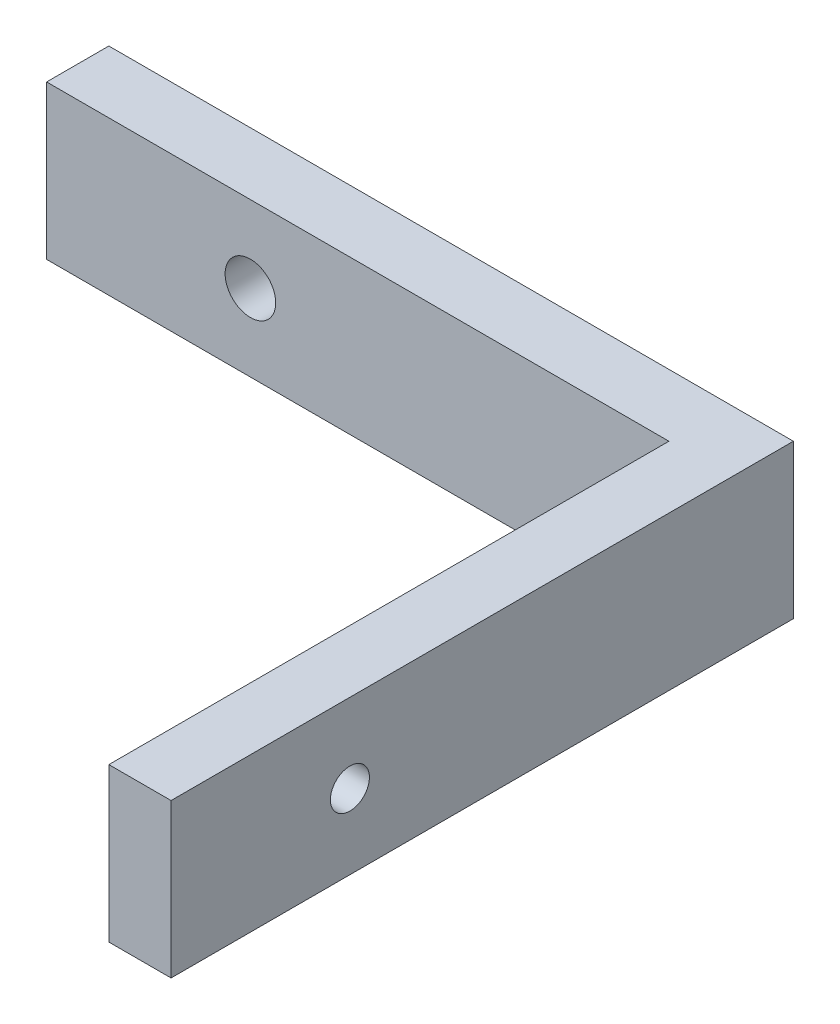
from build123d import *

# Parameters (mm, degrees)
SKETCH_1_W      = 65.498017076
SKETCH_1_H      = 24.698375637
SKETCH_1_R      = 4.065381732
EXTRUDE_1_DEPTH = 10
SKETCH_2_W      = 34.501982924
SKETCH_2_H      = 24.698375637
EXTRUDE_2_DEPTH = 10
SKETCH_3_W      = 100
SKETCH_3_H      = 24.698375637
SKETCH_3_R      = 3.135440561
EXTRUDE_3_DEPTH = 10


with BuildPart() as part:
    # 草图1 → 凸台-拉伸1 (new body)
    with BuildSketch(Plane.XY):
        with Locations((39.890553187, 50.738604847)):
            Rectangle(SKETCH_1_W, SKETCH_1_H)
        with Locations((39.890553187, 50.738604847)):
            Circle(SKETCH_1_R, mode=Mode.SUBTRACT)
    extrude(amount=-EXTRUDE_1_DEPTH)

    # 草图2 → 凸台-拉伸2 (add)
    with BuildSketch(Plane(origin=(0, 0, -10), x_dir=(-1, 0, 0), z_dir=(0, 0, -1))):
        with Locations((-89.890553187, 50.738604847)):
            Rectangle(SKETCH_2_W, SKETCH_2_H)
    extrude(amount=-EXTRUDE_2_DEPTH)

    # 草图3 → 凸台-拉伸3 (add)
    with BuildSketch(Plane(origin=(107.141544649, 0, 0), x_dir=(0, 0, -1), z_dir=(1, 0, 0))):
        with Locations((-40, 50.738604847)):
            Rectangle(SKETCH_3_W, SKETCH_3_H)
        with Locations((-61.264027464, 50.387155503)):
            Circle(SKETCH_3_R, mode=Mode.SUBTRACT)
    extrude(amount=EXTRUDE_3_DEPTH)


solid = part.part
